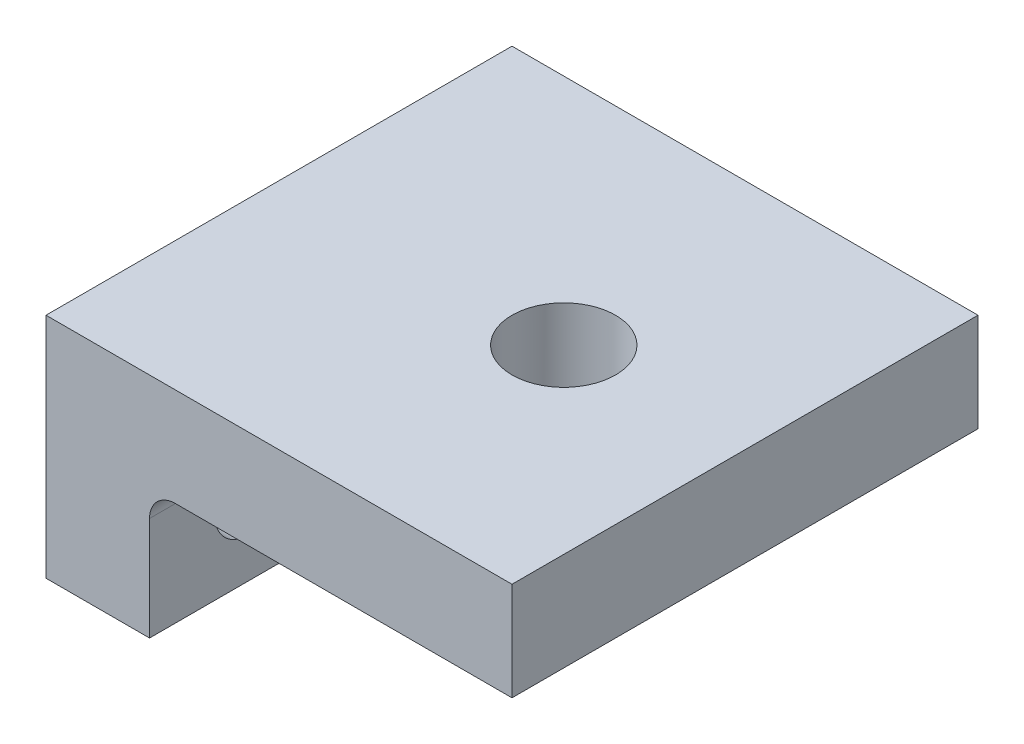
from build123d import *

# Parameters (mm, degrees)
BOSS_EXTRUDE1_DEPTH = 45.72
SKETCH2_R           = 1.5
CUT_EXTRUDE1_DEPTH  = 45.72
FILLET1_R           = 2.54
SKETCH11_R          = 3.175
CUT_EXTRUDE5_DEPTH  = 2.54
SKETCH12_R          = 5.08
CUT_EXTRUDE6_DEPTH  = 69.412343214


with BuildPart() as part:
    # Sketch1 → Boss-Extrude1 (new body)
    with BuildSketch(Plane.XY):
        Polygon((0, 0), (0, -22.352), (10.16, -22.352), (10.16, -9.652), (45.72, -9.652), (45.72, 0), align=None)
    extrude(amount=BOSS_EXTRUDE1_DEPTH)

    # Sketch2 → Cut-Extrude1 (cut)
    with BuildSketch(Plane.ZY):
        with Locations((9.6139, -15.24)):
            Circle(SKETCH2_R)
        with Locations((36.1061, -15.24)):
            Circle(SKETCH2_R)
    extrude(amount=-CUT_EXTRUDE1_DEPTH, mode=Mode.SUBTRACT)

    # Fillet1
    fillet1_edges = [part.edges().sort_by_distance(p)[0] for p in [
        (10.16, -9.652, 22.86),
    ]]
    fillet(fillet1_edges, radius=FILLET1_R)

    # Sketch11 → Cut-Extrude5 (cut)
    with BuildSketch(Plane(origin=(10.16, 0, 0), x_dir=(0, 0, -1), z_dir=(1, 0, 0))):
        with Locations((-36.1061, -15.24)):
            Circle(SKETCH11_R)
        with Locations((-9.6139, -15.24)):
            Circle(SKETCH11_R)
    extrude(amount=-CUT_EXTRUDE5_DEPTH, mode=Mode.SUBTRACT)

    # Sketch12 → Cut-Extrude6 (cut, through all)
    with BuildSketch(Plane(origin=(0, 0, 0), x_dir=(1, 0, 0), z_dir=(0, 1, 0))):
        with Locations((27.94, -22.86)):
            Circle(SKETCH12_R)
    extrude(amount=-CUT_EXTRUDE6_DEPTH, mode=Mode.SUBTRACT)


solid = part.part
